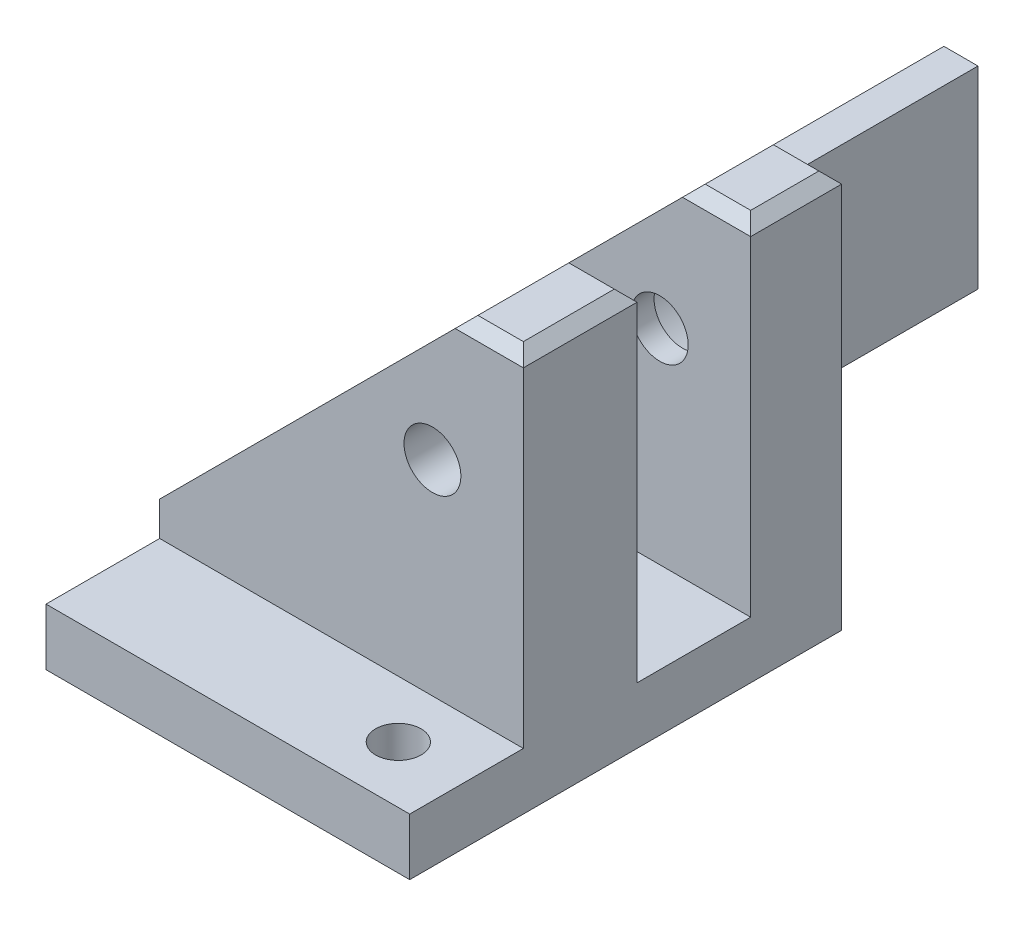
from build123d import *

# Parameters (mm, degrees)
EXTRUDE_1_DEPTH      = 70
SKETCH_3_W           = 10
SKETCH_3_H           = 30
CUT_EXTRUDE_2_DEPTH  = 92.104335791
CUT_EXTRUDE_3_DEPTH  = 87.02325267
SKETCH_5_W           = 10
SKETCH_5_H           = 25
CUT_EXTRUDE_4_DEPTH  = 83.607505712
SKETCH_8_W           = 32
SKETCH_8_H           = 25
CUT_EXTRUDE_5_DEPTH  = 27
CUT_EXTRUDE_6_DEPTH  = 81.802227692
SKETCH_10_R          = 6.3
CUT_EXTRUDE_7_DEPTH  = 6
SKETCH_11_R          = 2.5
CUT_EXTRUDE_8_DEPTH  = 63.801273872
SKETCH_12_R          = 2
CUT_EXTRUDE_9_DEPTH  = 87.02325267
CUT_EXTRUDE_10_REACH = 88.023
SKETCH_13_R          = 2
CUT_EXTRUDE_11_DEPTH = 10
SKETCH_15_W          = 12
SKETCH_15_H          = 32
EXTRUDE_2_DEPTH      = 20
CUT_EXTRUDE_12_DEPTH = 63.801273872
CUT_EXTRUDE_13_DEPTH = 32
SKETCH_18_W          = 20
SKETCH_18_H          = 32
CUT_EXTRUDE_14_DEPTH = 85.409715081
EXTRUDE_3_DEPTH      = 28
SKETCH_21_W          = 10
SKETCH_21_H          = 5
CUT_EXTRUDE_15_DEPTH = 85.551759296
CHAMFER_1_SIZE       = 1
CHAMFER_2_SIZE       = 1
SKETCH_22_R          = 2
CUT_EXTRUDE_16_DEPTH = 20


with BuildPart() as part:
    # 草图1 → 拉伸1 (new body)
    with BuildSketch(Plane.XY):
        Polygon((0, 0), (50, 0), (50, 30), (30, 30), align=None)
    extrude(amount=EXTRUDE_1_DEPTH)

    # 草图3 → 切除-拉伸2 (cut, through all)
    with BuildSketch(Plane.XY.offset(70)):
        with Locations((45, 15)):
            Rectangle(SKETCH_3_W, SKETCH_3_H)
    extrude(amount=-CUT_EXTRUDE_2_DEPTH, mode=Mode.SUBTRACT)

    # 草图4 → 切除-拉伸3 (cut, through all)
    with BuildSketch(Plane.XY.offset(70)):
        Polygon((0, 0), (8, 8), (8, 0), align=None)
    extrude(amount=-CUT_EXTRUDE_3_DEPTH, mode=Mode.SUBTRACT)

    # 草图5 → 切除-拉伸4 (cut, through all)
    with BuildSketch(Plane(origin=(40, 0, 0), x_dir=(0, 0, -1), z_dir=(1, 0, 0))):
        with Locations((-65, 17.5)):
            Rectangle(SKETCH_5_W, SKETCH_5_H)
        with Locations((-45, 17.5)):
            Rectangle(SKETCH_5_W, SKETCH_5_H)
    extrude(amount=-CUT_EXTRUDE_4_DEPTH, mode=Mode.SUBTRACT)

    # 草图8 → 切除-拉伸5 (cut)
    with BuildSketch(Plane.ZY.offset(-8)):
        with Locations((16, 17.5)):
            Rectangle(SKETCH_8_W, SKETCH_8_H)
    extrude(amount=-CUT_EXTRUDE_5_DEPTH, mode=Mode.SUBTRACT)

    # 草图9 → 切除-拉伸6 (cut, through all)
    with BuildSketch(Plane.ZY.offset(-35)):
        Polygon((0, 30), (32, 30), (0, 5), align=None)
    extrude(amount=-CUT_EXTRUDE_6_DEPTH, mode=Mode.SUBTRACT)

    # 草图10 → 切除-拉伸7 (cut)
    with BuildSketch(Plane(origin=(0, 0, 32), x_dir=(-1, 0, 0), z_dir=(0, 0, -1))):
        with Locations((-32, 23)):
            Circle(SKETCH_10_R)
    extrude(amount=-CUT_EXTRUDE_7_DEPTH, mode=Mode.SUBTRACT)

    # 草图11 → 切除-拉伸8 (cut, through all)
    with BuildSketch(Plane(origin=(0, 0, 38), x_dir=(-1, 0, 0), z_dir=(0, 0, -1))):
        with Locations((-32, 23)):
            Circle(SKETCH_11_R)
    extrude(amount=-CUT_EXTRUDE_8_DEPTH, mode=Mode.SUBTRACT)

    # 草图12 → 切除-拉伸9 (cut, through all)
    with BuildSketch(Plane.XZ):
        with Locations(Location((14, 10, 0), (0, 0, 270))):
            Circle(SKETCH_12_R)
    extrude(amount=-CUT_EXTRUDE_9_DEPTH, mode=Mode.SUBTRACT)

    # 草图13 → 切除-拉伸10 (cut, up to next)
    with BuildSketch(Plane.XZ, mode=Mode.PRIVATE) as cut_extrude_10_sk1:
        with Locations(Location((34, 65, 0), (0, 0, 270))):
            Circle(SKETCH_13_R)
    cut_extrude_10_tool1 = extrude(cut_extrude_10_sk1.sketch, amount=-CUT_EXTRUDE_10_REACH, mode=Mode.PRIVATE) & part.part
    add(cut_extrude_10_tool1.solids().sort_by_distance((34, 0, 65))[0], mode=Mode.SUBTRACT)

    # 草图14 → 切除-拉伸11 (cut)
    with BuildSketch(Plane.ZY.offset(-35)):
        Polygon((32, 30), (32, 5), (0, 5), align=None)
    extrude(amount=-CUT_EXTRUDE_11_DEPTH, mode=Mode.SUBTRACT)

    # 草图15 → 拉伸2 (add)
    with BuildSketch(Plane(origin=(0, 5, 0), x_dir=(-1, 0, 0), z_dir=(0, 1, 0))):
        with Locations((-14, 16)):
            Rectangle(SKETCH_15_W, SKETCH_15_H)
    extrude(amount=EXTRUDE_2_DEPTH)

    # 草图16 → 切除-拉伸12 (cut, through all)
    with BuildSketch(Plane.XY.offset(32)):
        Polygon((20, 25), (20, 20), (8, 8), (8, 25), align=None)
    extrude(amount=-CUT_EXTRUDE_12_DEPTH, mode=Mode.SUBTRACT)

    # 草图17 → 切除-拉伸13 (cut)
    with BuildSketch(Plane(origin=(0, 0, 0), x_dir=(-1, 0, 0), z_dir=(0, 0, -1))):
        Polygon((-20, 20), (-20, 17), (-17, 17), align=None)
    extrude(amount=-CUT_EXTRUDE_13_DEPTH, mode=Mode.SUBTRACT)

    # 草图18 → 切除-拉伸14 (cut, through all)
    with BuildSketch(Plane(origin=(0, 5, 0), x_dir=(-1, 0, 0), z_dir=(0, 1, 0))):
        with Locations((-30, 16)):
            Rectangle(SKETCH_18_W, SKETCH_18_H)
    extrude(amount=-CUT_EXTRUDE_14_DEPTH, mode=Mode.SUBTRACT)

    # 草图20 → 拉伸3 (add)
    with BuildSketch(Plane.XY.offset(60)):
        Polygon((30, 30), (35, 35), (40, 35), (40, 30), align=None)
    extrude(amount=-EXTRUDE_3_DEPTH)

    # 草图21 → 切除-拉伸15 (cut, through all)
    with BuildSketch(Plane(origin=(40, 0, 0), x_dir=(0, 0, -1), z_dir=(1, 0, 0))):
        with Locations((-45, 32.5)):
            Rectangle(SKETCH_21_W, SKETCH_21_H)
    extrude(amount=-CUT_EXTRUDE_15_DEPTH, mode=Mode.SUBTRACT)

    # 倒角1
    chamfer_1_edges = [part.edges().sort_by_distance(p)[0] for p in [
        (37.5, 35, 60),
        (37.5, 35, 32),
        (37.5, 35, 40),
        (37.5, 35, 50),
    ]]
    chamfer(chamfer_1_edges, length=CHAMFER_1_SIZE)

    # 倒角2
    chamfer_2_edges = [part.edges().sort_by_distance(p)[0] for p in [
        (40, 35, 36),
        (40, 35, 55),
    ]]
    chamfer(chamfer_2_edges, length=CHAMFER_2_SIZE)

    # 草图22 → 切除-拉伸16 (cut)
    with BuildSketch(Plane.XZ.offset(-5)):
        with Locations(Location((14, 10, 0), (0, 0, 270))):
            Circle(SKETCH_22_R)
    extrude(amount=-CUT_EXTRUDE_16_DEPTH, mode=Mode.SUBTRACT)


solid = part.part
